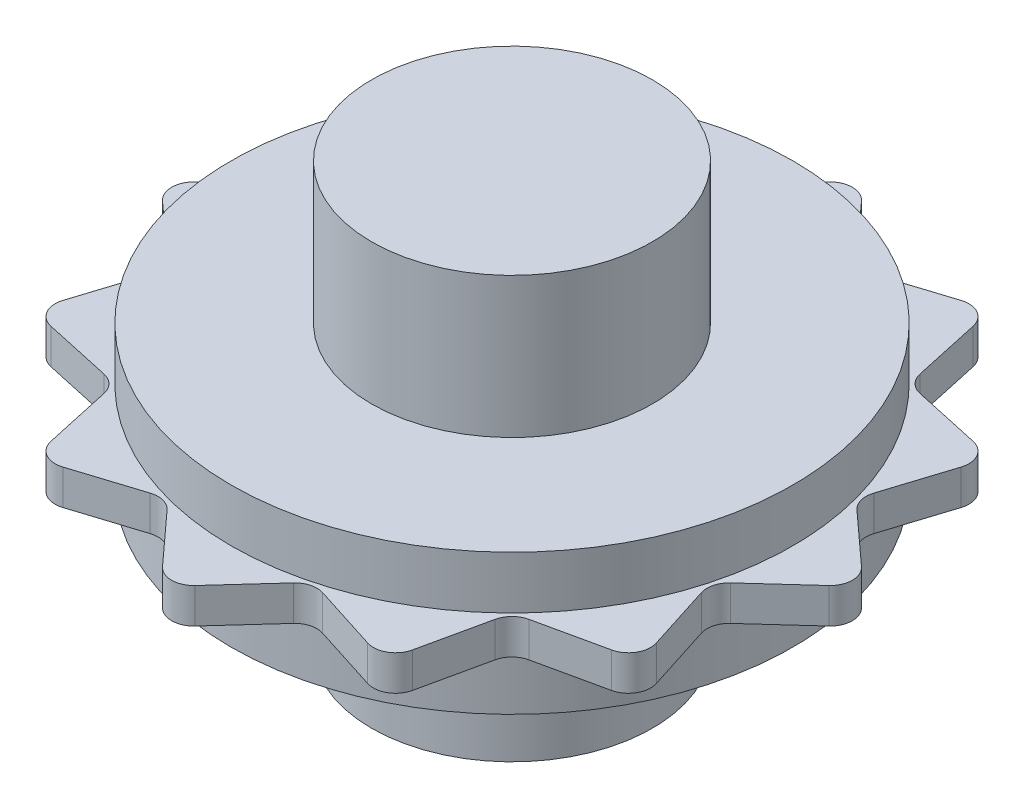
from build123d import *

# Parameters (mm, degrees)
SKETCH1_R           = 6.35
BOSS_EXTRUDE1_DEPTH = 19.05
BOSS_EXTRUDE2_START = 6.35
SKETCH2_R           = 12.7
BOSS_EXTRUDE2_DEPTH = 6.35
BOSS_EXTRUDE3_DEPTH = 0.79375
CIRPATTERN1_COUNT   = 12


with BuildPart() as part:
    # Sketch1 → Boss-Extrude1 (new body)
    with BuildSketch(Plane(origin=(0, 0, 0), x_dir=(1, 0, 0), z_dir=(0, 1, 0))):
        with Locations(Location((0, 0, 0), (0, 0, 270))):
            Circle(SKETCH1_R)
    extrude(amount=BOSS_EXTRUDE1_DEPTH)

    # Sketch2 → Boss-Extrude2 (add)
    with BuildSketch(Plane(origin=(0, 0, 0), x_dir=(1, 0, 0), z_dir=(0, 1, 0)).offset(BOSS_EXTRUDE2_START)):
        with Locations(Location((0, 0, 0), (0, 0, 270))):
            Circle(SKETCH2_R)
    extrude(amount=BOSS_EXTRUDE2_DEPTH)

    # Sketch3 → Boss-Extrude3 (add, symmetric)
    with BuildSketch(Plane(origin=(0, 9.525, 0), x_dir=(1, 0, 0), z_dir=(0, 1, 0))):
        with BuildLine():
            Line((-6.891666757, -13.415120246), (-3.89786608, -12.461780366))
            ThreePointArc((-3.89786608, -12.461780366), (-3.335621729, -12.448709767), (-2.855239137, -12.741151414))
            Line((-2.855239137, -12.741151414), (-0.739201637, -15.063668306))
            ThreePointArc((-0.739201637, -15.063668306), (-0.404051866, -15.304920203), (0, -15.390184127))
            Line((0, -15.390184127), (0, -12.7))
            Line((0, -12.7), (-6.35, -10.998522628))
            Line((-6.35, -10.998522628), (-7.695092063, -13.328290423))
            ThreePointArc((-7.695092063, -13.328290423), (-7.302540921, -13.456475632), (-6.891666757, -13.415120246))
        make_face()
    boss_extrude3 = extrude(amount=BOSS_EXTRUDE3_DEPTH, both=True)

    # CirPattern1: Boss-Extrude3 ×12 about axis
    cirpattern1_axis = Axis((0, 0, 0), (0, 1, 0))
    for i in range(1, CIRPATTERN1_COUNT):
        add(boss_extrude3.rotate(cirpattern1_axis, i * 360 / CIRPATTERN1_COUNT))


solid = part.part
